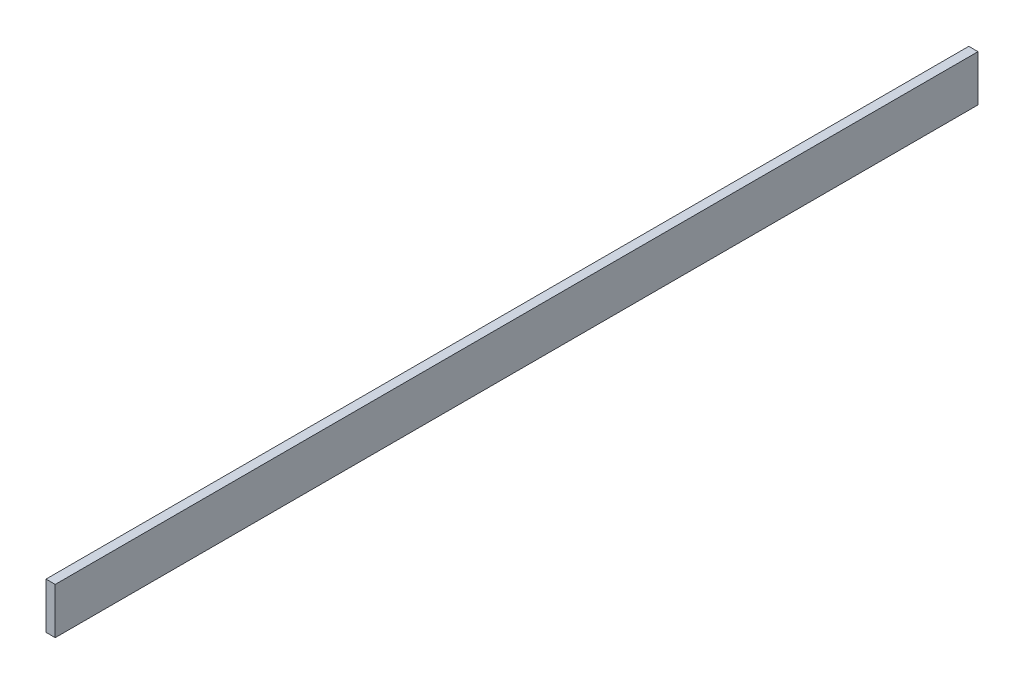
from build123d import *

# Parameters (mm, degrees)
SKETCH1_W           = 20
SKETCH1_H           = 100
BOSS_EXTRUDE1_DEPTH = 2000


with BuildPart() as part:
    # Sketch1 → Boss-Extrude1 (new body)
    with BuildSketch(Plane.XY):
        Rectangle(SKETCH1_W, SKETCH1_H)
    extrude(amount=BOSS_EXTRUDE1_DEPTH)


solid = part.part
